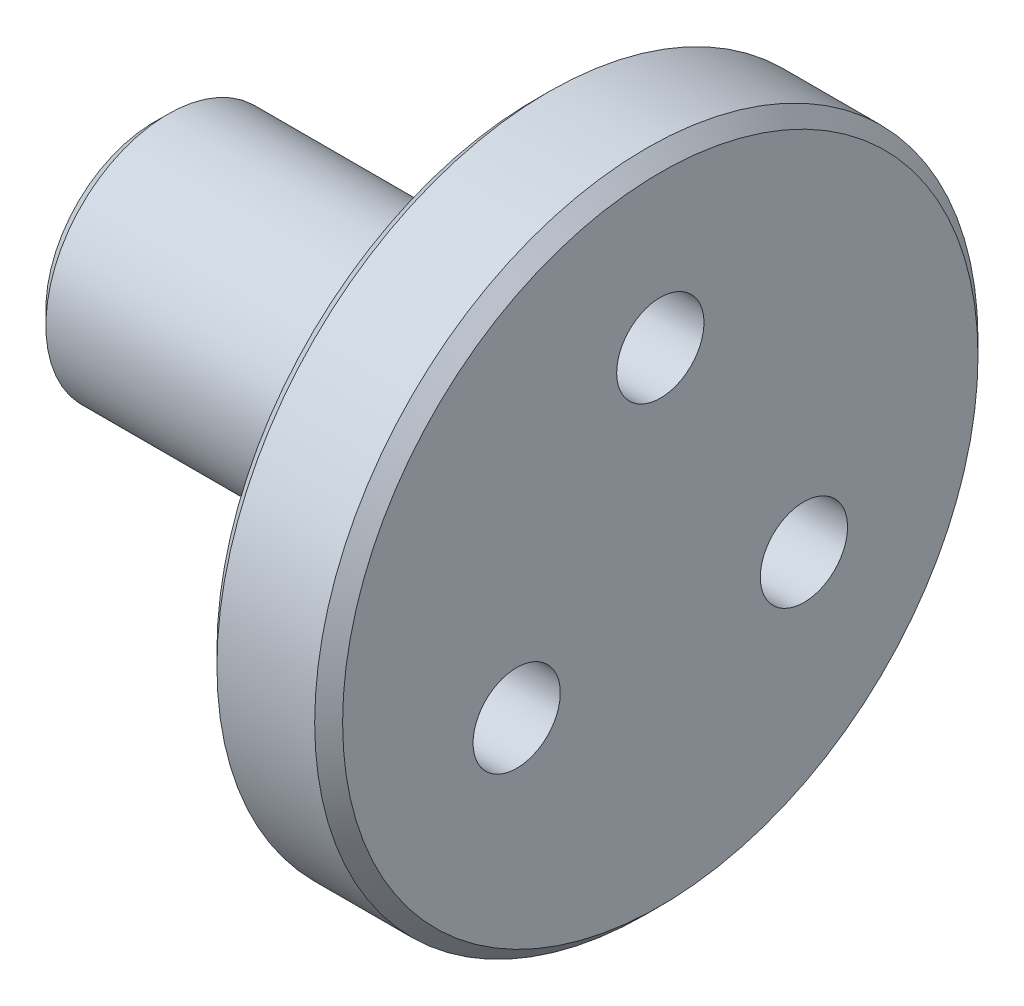
from build123d import *

# Parameters (mm, degrees)
SKETCH_3_R               = 1.25
CUT_EXTRUDE_1_DEPTH      = 18.300578025
CHAMFER_1_SIZE           = 0.4
PATTERN_CIRCULAR_1_COUNT = 3


with BuildPart() as part:
    # Эскиз2 → Повернуть1 (revolve)
    with BuildSketch(Plane.XY, mode=Mode.PRIVATE) as revolve_1_sk:
        Polygon((0, 0), (0, 9.5), (-3.6, 9.5), (-3.6, 3.5), (-14.5, 3.5), (-14.5, 0), align=None)
    revolve(revolve_1_sk.sketch.rotate(Axis((-14.5, 0, 0), (1, 0, 0)), 90), axis=Axis((-14.5, 0, 0), (1, 0, 0)))

    # Эскиз3 → Вырез-Вытянуть1 (cut, through all)
    with BuildSketch(Plane.ZY.offset(3.6)):
        with Locations((0, 4.75)):
            Circle(SKETCH_3_R)
    cut_extrude_1 = extrude(amount=-CUT_EXTRUDE_1_DEPTH, mode=Mode.SUBTRACT)

    # Фаска1
    chamfer_1_edges = [part.edges().sort_by_distance(p)[0] for p in [
        (-14.5, 0, -3.5),
        (-3.6, 0, -9.5),
        (0, 0, -9.5),
    ]]
    chamfer(chamfer_1_edges, length=CHAMFER_1_SIZE)

    # Круговой массив1: Вырез-Вытянуть1 ×3 about axis
    pattern_circular_1_axis = Axis((0, 0, 0), (1, 0, 0))
    for i in range(1, PATTERN_CIRCULAR_1_COUNT):
        add(cut_extrude_1.rotate(pattern_circular_1_axis, i * 360 / PATTERN_CIRCULAR_1_COUNT), mode=Mode.SUBTRACT)


solid = part.part
